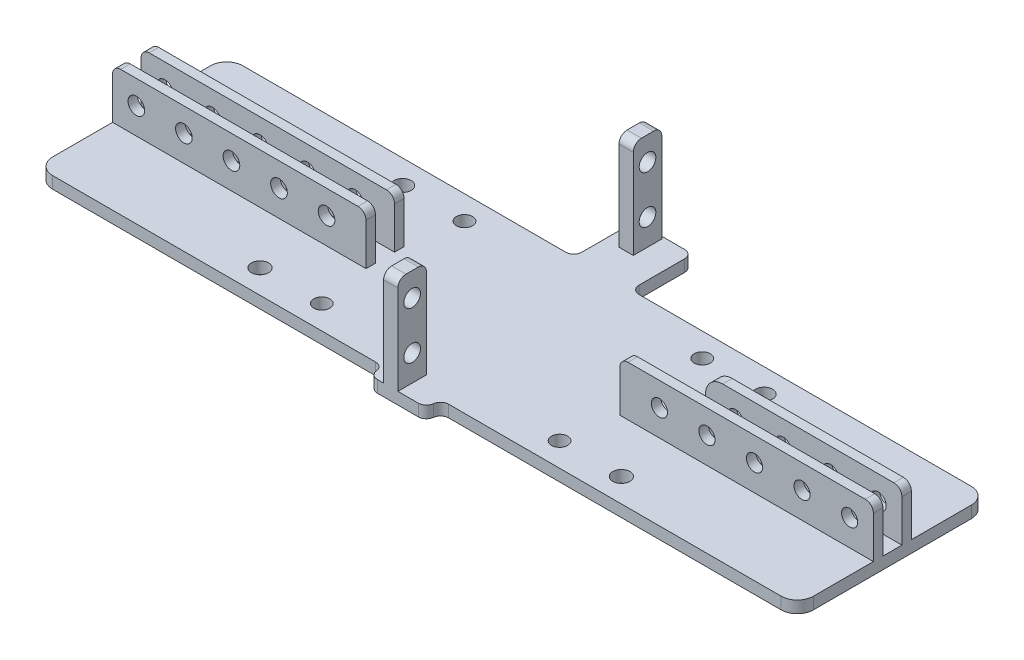
from build123d import *

# Parameters (mm, degrees)
SKETCH_1_W               = 160
SKETCH_1_H               = 40
SKETCH_1_R               = 1.7
EXTRUDE_2_DEPTH          = 2.5
FILLET_2_R               = 3.4
SKETCH_2_W               = 12
SKETCH_2_H               = 16.5
SKETCH_2_H_2             = 6
EXTRUDE_3_DEPTH          = 2.5
FILLET_4_R               = 1.7
FILLET_5_R               = 1.7
SKETCH_3_W               = 3
SKETCH_3_H               = 6
EXTRUDE_4_DEPTH          = 20.5
SKETCH_4_R               = 1.75
CUT_EXTRUDE_1_DEPTH      = 20.5
FILLET_6_R               = 1.7
SKETCH_5_W               = 53.3
SKETCH_5_H               = 2
EXTRUDE_6_DEPTH          = 10.5
CUT_EXTRUDE_2_DEPTH      = 10.5
CUT_EXTRUDE_2_DEPTH_BACK = 10.5
SKETCH_6_R               = 1.75
SKETCH_6_R_2             = 1.7
FILLET_7_R               = 1.7
SKETCH_7_R               = 1.8
CUT_EXTRUDE_3_DEPTH      = 10
SKETCH_8_W               = 10
SKETCH_8_H               = 10.5
SKETCH_8_W_2             = 2
CUT_EXTRUDE_4_DEPTH      = 2
FILLET_8_R               = 3.6


with BuildPart() as part:
    # 草图1 → 凸台-拉伸2 (new body)
    with BuildSketch(Plane(origin=(0, 0, 0), x_dir=(1, 0, 0), z_dir=(0, 1, 0))):
        Rectangle(SKETCH_1_W, SKETCH_1_H)
        with Locations(Location((-25, 15, 0), (0, 0, 270))):
            Circle(SKETCH_1_R, mode=Mode.SUBTRACT)
        with Locations(Location((25, 15, 0), (0, 0, 270))):
            Circle(SKETCH_1_R, mode=Mode.SUBTRACT)
        with Locations(Location((25, -15, 0), (0, 0, 270))):
            Circle(SKETCH_1_R, mode=Mode.SUBTRACT)
        with Locations(Location((-25, -15, 0), (0, 0, 270))):
            Circle(SKETCH_1_R, mode=Mode.SUBTRACT)
    extrude(amount=-EXTRUDE_2_DEPTH)

    # 圆角2
    fillet_2_edges = [part.edges().sort_by_distance(p)[0] for p in [
        (80, -1.25, 20),
        (-80, -1.25, 20),
        (-80, -1.25, -20),
        (80, -1.25, -20),
    ]]
    fillet(fillet_2_edges, radius=FILLET_2_R)

    # 草图2 → 凸台-拉伸3 (add)
    with BuildSketch(Plane(origin=(0, 0, 0), x_dir=(1, 0, 0), z_dir=(0, 1, 0))):
        with Locations((-1, 24.75)):
            Rectangle(SKETCH_2_W, SKETCH_2_H)
        with Locations((-1, -20)):
            Rectangle(SKETCH_2_W, SKETCH_2_H_2)
    extrude(amount=-EXTRUDE_3_DEPTH)

    # 圆角4
    fillet_4_edges = [part.edges().sort_by_distance(p)[0] for p in [
        (-7, -1.25, -33),
        (5, -1.25, -33),
        (-7, -1.25, 23),
        (5, -1.25, 23),
    ]]
    fillet(fillet_4_edges, radius=FILLET_4_R)

    # 圆角5
    fillet_5_edges = [part.edges().sort_by_distance(p)[0] for p in [
        (5, -1.25, 20),
        (-7, -1.25, 20),
        (5, -1.25, -20),
        (-7, -1.25, -20),
    ]]
    fillet(fillet_5_edges, radius=FILLET_5_R)

    # 草图3 → 凸台-拉伸4 (add)
    with BuildSketch(Plane(origin=(0, 0, 0), x_dir=(1, 0, 0), z_dir=(0, 1, 0))):
        with Locations((-2.5, 29.5)):
            Rectangle(SKETCH_3_W, SKETCH_3_H)
        with Locations((-2.5, -20)):
            Rectangle(SKETCH_3_W, SKETCH_3_H)
    extrude(amount=EXTRUDE_4_DEPTH)

    # 草图4 → 切除-拉伸1 (cut)
    with BuildSketch(Plane(origin=(0, 0, 0), x_dir=(0, 0, -1), z_dir=(1, 0, 0))):
        with Locations((-20, 15.5)):
            Circle(SKETCH_4_R)
        with Locations((-20, 5.5)):
            Circle(SKETCH_4_R)
        with Locations((29.5, 15.5)):
            Circle(SKETCH_4_R)
        with Locations((29.5, 5.5)):
            Circle(SKETCH_4_R)
    extrude(amount=-CUT_EXTRUDE_1_DEPTH, mode=Mode.SUBTRACT)

    # 圆角6
    fillet_6_edges = [part.edges().sort_by_distance(p)[0] for p in [
        (-2.5, 20.5, -32.5),
        (-2.5, 20.5, -26.5),
        (-2.5, 20.5, 17),
        (-2.5, 20.5, 23),
    ]]
    fillet(fillet_6_edges, radius=FILLET_6_R)

    # 草图5 → 凸台-拉伸6 (add)
    with BuildSketch(Plane(origin=(0, 0, 0), x_dir=(1, 0, 0), z_dir=(0, 1, 0))):
        with Locations((-53.35, -3)):
            Rectangle(SKETCH_5_W, SKETCH_5_H)
        with Locations((-53.35, 3)):
            Rectangle(SKETCH_5_W, SKETCH_5_H)
        with Locations((53.35, 3)):
            Rectangle(SKETCH_5_W, SKETCH_5_H)
        with Locations((53.35, -3)):
            Rectangle(SKETCH_5_W, SKETCH_5_H)
    extrude(amount=EXTRUDE_6_DEPTH)

    # 草图6 → 切除-拉伸2 (cut, two sides: drawn at the far end of the back side and taken through both)
    with BuildSketch(Plane.XY.offset(-CUT_EXTRUDE_2_DEPTH_BACK)):
        with Locations(Location((-75, 5.5, 0), (0, 0, 180))):
            Circle(SKETCH_6_R)
        with Locations(Location((-65, 5.5, 0), (0, 0, 180))):
            Circle(SKETCH_6_R)
        with Locations(Location((-55, 5.5, 0), (0, 0, 180))):
            Circle(SKETCH_6_R)
        with Locations(Location((-45, 5.5, 0), (0, 0, 180))):
            Circle(SKETCH_6_R)
        with Locations(Location((-35, 5.5, 0), (0, 0, 180))):
            Circle(SKETCH_6_R)
        with Locations(Location((75, 5.5, 0), (0, 0, 180))):
            Circle(SKETCH_6_R_2)
        with Locations(Location((65, 5.5, 0), (0, 0, 180))):
            Circle(SKETCH_6_R_2)
        with Locations(Location((55, 5.5, 0), (0, 0, 180))):
            Circle(SKETCH_6_R_2)
        with Locations(Location((45, 5.5, 0), (0, 0, 180))):
            Circle(SKETCH_6_R_2)
        with Locations(Location((35, 5.5, 0), (0, 0, 180))):
            Circle(SKETCH_6_R_2)
    extrude(amount=CUT_EXTRUDE_2_DEPTH + CUT_EXTRUDE_2_DEPTH_BACK, mode=Mode.SUBTRACT)

    # 圆角7
    fillet_7_edges = [part.edges().sort_by_distance(p)[0] for p in [
        (-80, 10.5, 3),
        (-26.7, 10.5, 3),
        (-80, 10.5, -3),
        (-26.7, 10.5, -3),
        (80, 10.5, -3),
        (26.7, 10.5, -3),
        (80, 10.5, 3),
        (26.7, 10.5, 3),
    ]]
    fillet(fillet_7_edges, radius=FILLET_7_R)

    # 草图7 → 切除-拉伸3 (cut)
    with BuildSketch(Plane(origin=(0, 0, 0), x_dir=(1, 0, 0), z_dir=(0, 1, 0))):
        with Locations(Location((38, 15, 0), (0, 0, 270))):
            Circle(SKETCH_7_R)
        with Locations(Location((38, -15, 0), (0, 0, 270))):
            Circle(SKETCH_7_R)
        with Locations(Location((-38, 15, 0), (0, 0, 270))):
            Circle(SKETCH_7_R)
        with Locations(Location((-38, -15, 0), (0, 0, 270))):
            Circle(SKETCH_7_R)
    extrude(amount=-CUT_EXTRUDE_3_DEPTH, mode=Mode.SUBTRACT)

    # 草图8 → 切除-拉伸4 (cut)
    with BuildSketch(Plane(origin=(0, 0, -4), x_dir=(-1, 0, 0), z_dir=(0, 0, -1))):
        with Locations((-31.7, 5.25)):
            Rectangle(SKETCH_8_W, SKETCH_8_H)
        with Locations((-37.7, 5.25)):
            Rectangle(SKETCH_8_W_2, SKETCH_8_H)
    extrude(amount=-CUT_EXTRUDE_4_DEPTH, mode=Mode.SUBTRACT)

    # 圆角8
    fillet_8_edges = [part.edges().sort_by_distance(p)[0] for p in [
        (38.7, 10.5, -3),
    ]]
    fillet(fillet_8_edges, radius=FILLET_8_R)


solid = part.part
